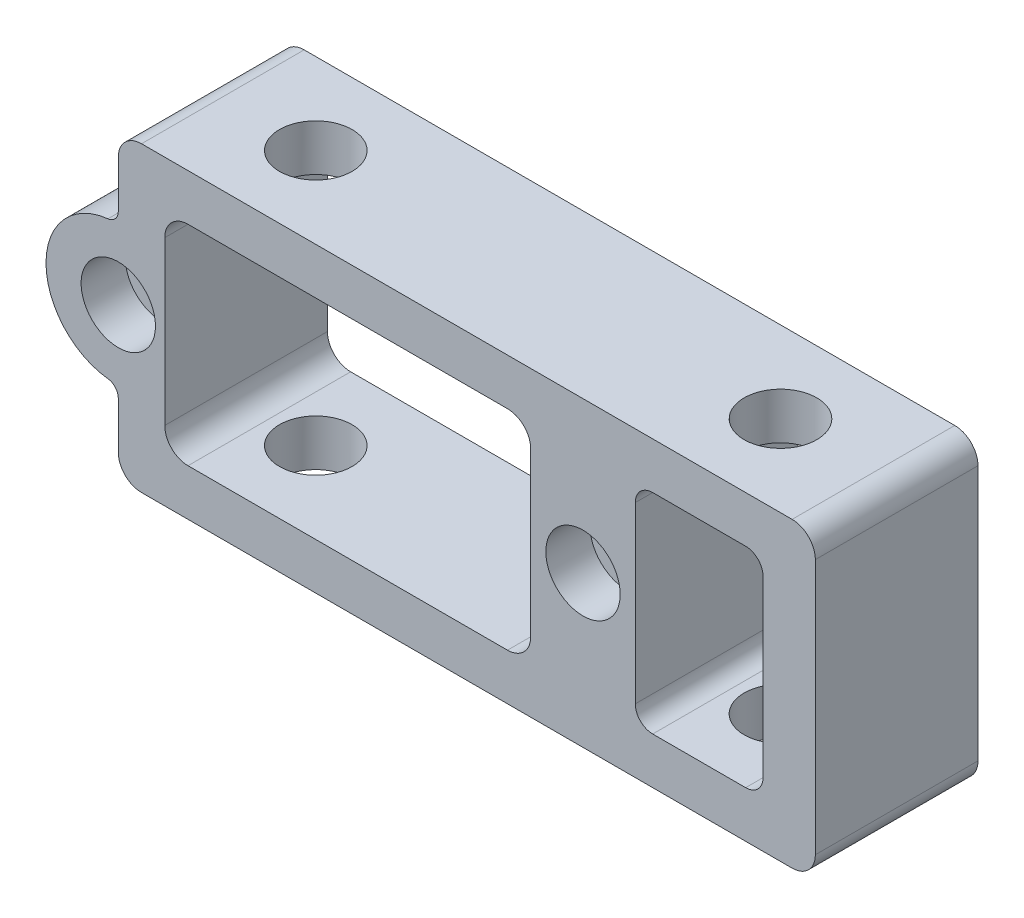
from build123d import *

# Parameters (mm, degrees)
SKETCH1_W           = 101.6
SKETCH1_H           = 17.78
SKETCH1_R           = 3.96875
BOSS_EXTRUDE1_DEPTH = 33.02
SKETCH2_R           = 2.4892
CUT_EXTRUDE1_DEPTH  = 17.78
SKETCH3_R           = 4.064
CUT_EXTRUDE2_DEPTH  = 4.826
CUT_EXTRUDE3_DEPTH  = 109.300548475
FILLET1_R           = 2.54
SKETCH6_W           = 13.97
SKETCH6_H           = 22.86
SKETCH6_W_2         = 10.94852006
SKETCH6_H_2         = 17.669906062
CUT_EXTRUDE4_DEPTH  = 104.812903953
FILLET2_R           = 1.905


with BuildPart() as part:
    # Sketch1 → Boss-Extrude1 (new body)
    with BuildSketch(Plane(origin=(0, 0, 0), x_dir=(1, 0, 0), z_dir=(0, 1, 0))):
        with Locations((50.8, 8.89)):
            Rectangle(SKETCH1_W, SKETCH1_H)
        with Locations(Location((76.2, 8.89, 0), (0, 0, 270))):
            Circle(SKETCH1_R, mode=Mode.SUBTRACT)
        with Locations(Location((25.4, 8.89, 0), (0, 0, 270))):
            Circle(SKETCH1_R, mode=Mode.SUBTRACT)
    extrude(amount=-BOSS_EXTRUDE1_DEPTH)

    # Sketch2 → Cut-Extrude1 (cut)
    with BuildSketch(Plane.XY):
        with Locations((63.5, -16.51)):
            Circle(SKETCH2_R)
        with Locations((12.7, -16.51)):
            Circle(SKETCH2_R)
    extrude(amount=-CUT_EXTRUDE1_DEPTH, mode=Mode.SUBTRACT)

    # Sketch3 → Cut-Extrude2 (cut)
    with BuildSketch(Plane.XY):
        with Locations((63.5, -16.51)):
            Circle(SKETCH3_R)
        with Locations((12.7, -16.51)):
            Circle(SKETCH3_R)
    extrude(amount=-CUT_EXTRUDE2_DEPTH, mode=Mode.SUBTRACT)

    # Sketch5 → Cut-Extrude3 (cut, through all)
    with BuildSketch(Plane.XY):
        with BuildLine():
            Line((12.7, -7.675046969), (12.7, 0))
            Line((12.7, 0), (0, 0))
            Line((0, 0), (0, -33.02))
            Line((0, -33.02), (12.7, -33.02))
            Line((12.7, -33.02), (12.7, -25.344953031))
            ThreePointArc((12.7, -25.344953031), (12.37660211, -24.498286364), (11.571111111, -24.082816884))
            ThreePointArc((11.571111111, -24.082816884), (4.797777778, -16.51), (11.571111111, -8.937183116))
            ThreePointArc((11.571111111, -8.937183116), (12.37660211, -8.521713636), (12.7, -7.675046969))
        make_face()
        with BuildLine():
            Line((88.9, -7.675046969), (88.9, 0))
            Line((88.9, 0), (101.6, 0))
            Line((101.6, 0), (101.6, -33.02))
            Line((101.6, -33.02), (88.9, -33.02))
            Line((88.9, -33.02), (88.9, -25.344953031))
            ThreePointArc((88.9, -25.344953031), (89.22339789, -24.498286364), (90.028888889, -24.082816884))
            ThreePointArc((90.028888889, -24.082816884), (96.802222222, -16.51), (90.028888889, -8.937183116))
            ThreePointArc((90.028888889, -8.937183116), (89.22339789, -8.521713636), (88.9, -7.675046969))
        make_face()
    extrude(amount=-CUT_EXTRUDE3_DEPTH, mode=Mode.SUBTRACT)

    # Fillet1
    fillet1_edges = [part.edges().sort_by_distance(p)[0] for p in [
        (12.7, -33.02, -8.89),
        (12.7, 0, -8.89),
        (88.9, 0, -8.89),
        (88.9, -33.02, -8.89),
    ]]
    fillet(fillet1_edges, radius=FILLET1_R)

    # Sketch6 → Cut-Extrude4 (cut, through all)
    with BuildSketch(Plane.XY):
        with BuildLine():
            Line((17.78, -25.4), (17.78, -7.62))
            ThreePointArc((17.78, -7.62), (18.523948776, -5.823948776), (20.32, -5.08))
            Line((20.32, -5.08), (55.245, -5.08))
            ThreePointArc((55.245, -5.08), (57.041051224, -5.823948776), (57.785, -7.62))
            Line((57.785, -7.62), (57.785, -25.4))
            ThreePointArc((57.785, -25.4), (57.041051224, -27.196051224), (55.245, -27.94))
            Line((55.245, -27.94), (20.32, -27.94))
            ThreePointArc((20.32, -27.94), (18.523948776, -27.196051224), (17.78, -25.4))
        make_face()
        with Locations((76.2, -16.51)):
            Rectangle(SKETCH6_W, SKETCH6_H)
        with Locations((94.37426003, -16.51)):
            Rectangle(SKETCH6_W_2, SKETCH6_H_2)
    extrude(amount=-CUT_EXTRUDE4_DEPTH, mode=Mode.SUBTRACT)

    # Fillet2
    fillet2_edges = [part.edges().sort_by_distance(p)[0] for p in [
        (69.215, -5.08, -8.89),
        (83.185, -27.94, -8.89),
        (83.185, -5.08, -8.89),
        (69.215, -27.94, -8.89),
    ]]
    fillet(fillet2_edges, radius=FILLET2_R)


solid = part.part
